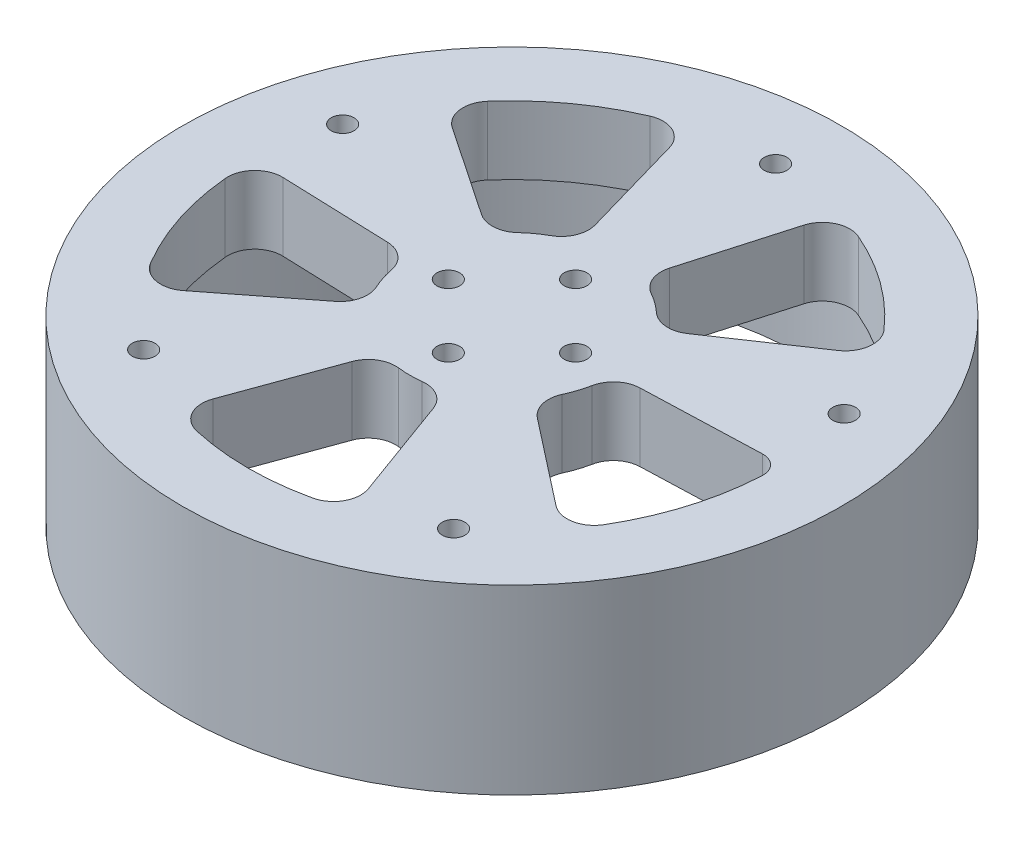
from build123d import *

# Parameters (mm, degrees)
SKETCH1_R           = 72.5
SKETCH1_R_2         = 64.5
BOSS_EXTRUDE1_DEPTH = 40
SKETCH4_R           = 64.5
BOSS_EXTRUDE3_DEPTH = 15
SKETCH3_R           = 2.5
CUT_EXTRUDE1_DEPTH  = 15
SKETCH6_R           = 2.5
CUT_EXTRUDE2_DEPTH  = 30
SKETCH7_R           = 72.5
CUT_EXTRUDE3_DEPTH  = 40


with BuildPart() as part:
    # Sketch1 → Boss-Extrude1 (new, symmetric)
    with BuildSketch(Plane(origin=(0, 0, 0), x_dir=(1, 0, 0), z_dir=(0, 1, 0))):
        with Locations(Location((0, 0, 0), (0, 0, 270))):
            Circle(SKETCH1_R)
        with Locations(Location((0, 0, 0), (0, 0, 270))):
            Circle(SKETCH1_R_2, mode=Mode.SUBTRACT)
    extrude(amount=BOSS_EXTRUDE1_DEPTH, both=True)

    # Sketch4 → Boss-Extrude3 (add, symmetric)
    with BuildSketch(Plane(origin=(0, 0, 0), x_dir=(1, 0, 0), z_dir=(0, 1, 0))):
        with Locations(Location((0, 0, 0), (0, 0, 270))):
            Circle(SKETCH4_R)
    extrude(amount=BOSS_EXTRUDE3_DEPTH, both=True)

    # Sketch3 → Cut-Extrude1 (cut, symmetric)
    with BuildSketch(Plane.XZ):
        with Locations(Location((-34.091544633, 46.922985674, 0), (0, 0, 270))):
            Circle(SKETCH3_R)
        with Locations(Location((34.091544633, 46.922985674, 0), (0, 0, 270))):
            Circle(SKETCH3_R)
        with Locations(Location((55.161277945, -17.922985674, 0), (0, 0, 270))):
            Circle(SKETCH3_R)
        with Locations(Location((0, -58, 0), (0, 0, 270))):
            Circle(SKETCH3_R)
        with Locations(Location((-55.161277945, -17.922985674, 0), (0, 0, 270))):
            Circle(SKETCH3_R)
        with BuildLine():
            Line((8.942342186, 26.255693464), (17.100089792, 48.668920804))
            ThreePointArc((17.100089792, 48.668920804), (16.728172015, 53.596235201), (12.784464921, 56.573469548))
            ThreePointArc((12.784464921, 56.573469548), (0, 58), (-12.784464921, 56.573469548))
            ThreePointArc((-12.784464921, 56.573469548), (-16.728172015, 53.596235201), (-17.100089792, 48.668920804))
            Line((-17.100089792, 48.668920804), (-8.942342186, 26.255693464))
            ThreePointArc((-8.942342186, 26.255693464), (-6.454448371, 23.201362532), (-2.608568259, 22.348274467))
            ThreePointArc((-2.608568259, 22.348274467), (0, 22.5), (2.608568259, 22.348274467))
            ThreePointArc((2.608568259, 22.348274467), (6.454448371, 23.201362532), (8.942342186, 26.255693464))
        make_face()
        with BuildLine():
            Line((22.207312654, 16.618128287), (41.002675921, 31.302675452))
            ThreePointArc((41.002675921, 31.302675452), (45.803759299, 32.471584512), (49.853949939, 29.640912191))
            ThreePointArc((49.853949939, 29.640912191), (55.525129356, 16.76186177), (57.927651105, 2.896072756))
            ThreePointArc((57.927651105, 2.896072756), (56.782266496, -0.110724751), (53.793042698, -1.301219707))
            Line((53.793042698, -1.301219707), (27.733984064, -0.391217328))
            ThreePointArc((27.733984064, -0.391217328), (24.060341259, 1.031070133), (22.060563983, 4.425100764))
            ThreePointArc((22.060563983, 4.425100764), (21.398771617, 6.952882373), (20.448380136, 9.386892446))
            ThreePointArc((20.448380136, 9.386892446), (20.071272788, 13.308160497), (22.207312654, 16.618128287))
        make_face()
        with BuildLine():
            Line((22.667216205, -15.985125354), (42.44113714, -29.322803436))
            ThreePointArc((42.44113714, -29.322803436), (45.036452074, -33.527692304), (43.595900456, -38.254378356))
            ThreePointArc((43.595900456, -38.254378356), (34.091544633, -46.922985674), (22.910201686, -53.283418234))
            ThreePointArc((22.910201686, -53.283418234), (17.969701185, -53.19283792), (14.772610647, -49.42516462))
            Line((14.772610647, -49.42516462), (8.198202609, -26.49747907))
            ThreePointArc((8.198202609, -26.49747907), (8.415660309, -22.564126145), (11.025610093, -19.613411791))
            ThreePointArc((11.025610093, -19.613411791), (13.225168177, -18.202882373), (15.246362198, -16.546855886))
            ThreePointArc((15.246362198, -16.546855886), (18.859177151, -14.976467017), (22.667216205, -15.985125354))
        make_face()
        with BuildLine():
            Line((-8.198202609, -26.49747907), (-14.772610647, -49.42516462))
            ThreePointArc((-14.772610647, -49.42516462), (-17.969701185, -53.19283792), (-22.910201686, -53.283418234))
            ThreePointArc((-22.910201686, -53.283418234), (-34.091544633, -46.922985674), (-43.595900456, -38.254378356))
            ThreePointArc((-43.595900456, -38.254378356), (-45.036452074, -33.527692304), (-42.44113714, -29.322803436))
            Line((-42.44113714, -29.322803436), (-22.667216205, -15.985125354))
            ThreePointArc((-22.667216205, -15.985125354), (-18.859177151, -14.976467017), (-15.246362198, -16.546855886))
            ThreePointArc((-15.246362198, -16.546855886), (-13.225168177, -18.202882373), (-11.025610093, -19.613411791))
            ThreePointArc((-11.025610093, -19.613411791), (-8.415660309, -22.564126145), (-8.198202609, -26.49747907))
        make_face()
        with BuildLine():
            Line((-27.733984064, -0.391217328), (-51.571112622, -1.223628199))
            ThreePointArc((-51.571112622, -1.223628199), (-56.142338174, 0.652710511), (-57.755183787, 5.323414851))
            ThreePointArc((-57.755183787, 5.323414851), (-55.161277945, 17.922985674), (-49.853949939, 29.640912191))
            ThreePointArc((-49.853949939, 29.640912191), (-45.803759299, 32.471584512), (-41.002675921, 31.302675452))
            Line((-41.002675921, 31.302675452), (-22.207312654, 16.618128287))
            ThreePointArc((-22.207312654, 16.618128287), (-20.071272788, 13.308160497), (-20.448380136, 9.386892446))
            ThreePointArc((-20.448380136, 9.386892446), (-21.398771617, 6.952882373), (-22.060563983, 4.425100764))
            ThreePointArc((-22.060563983, 4.425100764), (-24.060341259, 1.031070133), (-27.733984064, -0.391217328))
        make_face()
    extrude(amount=CUT_EXTRUDE1_DEPTH, both=True, mode=Mode.SUBTRACT)

    # Sketch6 → Cut-Extrude2 (cut)
    with BuildSketch(Plane(origin=(0, 15, 0), x_dir=(1, 0, 0), z_dir=(0, 1, 0))):
        with Locations(Location((0, 14, 0), (0, 0, 270))):
            Circle(SKETCH6_R)
        with Locations(Location((14, 0, 0), (0, 0, 270))):
            Circle(SKETCH6_R)
        with Locations(Location((0, -14, 0), (0, 0, 270))):
            Circle(SKETCH6_R)
        with Locations(Location((-14, 0, 0), (0, 0, 270))):
            Circle(SKETCH6_R)
    extrude(amount=-CUT_EXTRUDE2_DEPTH, mode=Mode.SUBTRACT)

    # Sketch7 → Cut-Extrude3 (cut)
    with BuildSketch(Plane(origin=(0, 40, 0), x_dir=(1, 0, 0), z_dir=(0, 1, 0))):
        with Locations(Location((0, 0, 0), (0, 0, 270))):
            Circle(SKETCH7_R)
    extrude(amount=-CUT_EXTRUDE3_DEPTH, mode=Mode.SUBTRACT)


solid = part.part
